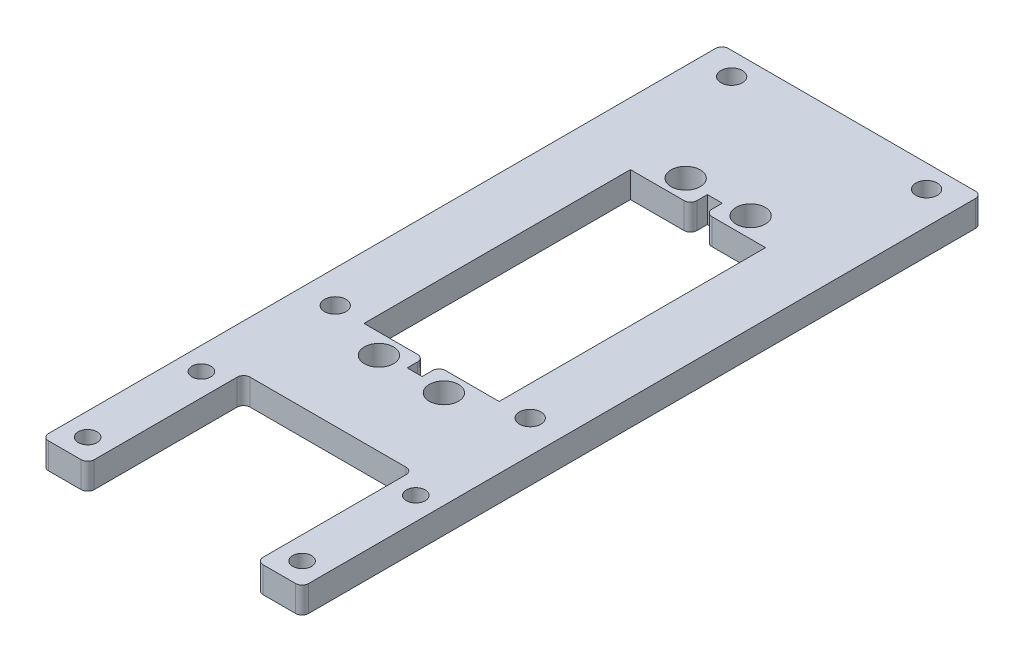
from build123d import *

# Parameters (mm, degrees)
SKETCH1_W           = 40
SKETCH1_H           = 104.6
BOSS_EXTRUDE1_DEPTH = 4
SKETCH2_R           = 1.65
CUT_EXTRUDE1_DEPTH  = 57.136351859
SKETCH3_R           = 2.25
CUT_EXTRUDE2_DEPTH  = 57.136351859
SKETCH4_R           = 1.45
SKETCH4_W           = 26
SKETCH4_H           = 24
CUT_EXTRUDE3_DEPTH  = 57.136351859
FILLET1_R           = 1


with BuildPart() as part:
    # Sketch1 → Boss-Extrude1 (new body)
    with BuildSketch(Plane(origin=(0, 0, 0), x_dir=(1, 0, 0), z_dir=(0, 1, 0))):
        Rectangle(SKETCH1_W, SKETCH1_H)
    extrude(amount=BOSS_EXTRUDE1_DEPTH)

    # Sketch2 → Cut-Extrude1 (cut, through all)
    with BuildSketch(Plane(origin=(0, 4, 0), x_dir=(1, 0, 0), z_dir=(0, 1, 0))):
        with Locations(Location((-15, 48.8, 0), (0, 0, 270))):
            Circle(SKETCH2_R)
        with Locations(Location((15, 48.8, 0), (0, 0, 270))):
            Circle(SKETCH2_R)
        with Locations(Location((-15, -12.2, 0), (0, 0, 270))):
            Circle(SKETCH2_R)
        with Locations(Location((15, -12.2, 0), (0, 0, 270))):
            Circle(SKETCH2_R)
    extrude(amount=-CUT_EXTRUDE1_DEPTH, mode=Mode.SUBTRACT)

    # Sketch3 → Cut-Extrude2 (cut, through all)
    with BuildSketch(Plane(origin=(0, 4, 0), x_dir=(1, 0, 0), z_dir=(0, 1, 0))):
        with Locations(Location((-5, 31.71959884, 0), (0, 0, 270))):
            Circle(SKETCH3_R)
        with Locations(Location((5, 31.71959884, 0), (0, 0, 270))):
            Circle(SKETCH3_R)
        with Locations(Location((-5, -15.48040116, 0), (0, 0, 270))):
            Circle(SKETCH3_R)
        with Locations(Location((5, -15.48040116, 0), (0, 0, 270))):
            Circle(SKETCH3_R)
        Polygon((-1.15, 31.21959884), (-1.15, 28.61959884), (-10.4, 28.61959884), (-10.4, -12.38040116), (-1.15, -12.38040116), (-1.15, -14.98040116), (1.15, -14.98040116), (1.15, -12.38040116), (10.4, -12.38040116), (10.4, 28.61959884), (1.15, 28.61959884), (1.15, 31.21959884), align=None)
    extrude(amount=-CUT_EXTRUDE2_DEPTH, mode=Mode.SUBTRACT)

    # Sketch4 → Cut-Extrude3 (cut, through all)
    with BuildSketch(Plane(origin=(0, 4, 0), x_dir=(1, 0, 0), z_dir=(0, 1, 0))):
        with Locations(Location((-16.5, -31.3, 0), (0, 0, 270))):
            Circle(SKETCH4_R)
        with Locations(Location((-16.5, -48.8, 0), (0, 0, 270))):
            Circle(SKETCH4_R)
        with Locations(Location((16.5, -31.3, 0), (0, 0, 270))):
            Circle(SKETCH4_R)
        with Locations(Location((16.5, -48.8, 0), (0, 0, 270))):
            Circle(SKETCH4_R)
        with Locations((0, -40.3)):
            Rectangle(SKETCH4_W, SKETCH4_H)
    extrude(amount=-CUT_EXTRUDE3_DEPTH, mode=Mode.SUBTRACT)

    # Fillet1
    fillet1_edges = [part.edges().sort_by_distance(p)[0] for p in [
        (-13, 2, 52.3),
        (-13, 2, 28.3),
        (13, 2, 28.3),
        (13, 2, 52.3),
        (1.15, 2, 12.38040116),
        (-1.15, 2, 12.38040116),
        (-1.15, 2, -28.61959884),
        (1.15, 2, -28.61959884),
        (20, 2, 52.3),
        (-20, 2, 52.3),
        (-20, 2, -52.3),
        (20, 2, -52.3),
    ]]
    fillet(fillet1_edges, radius=FILLET1_R)


solid = part.part
